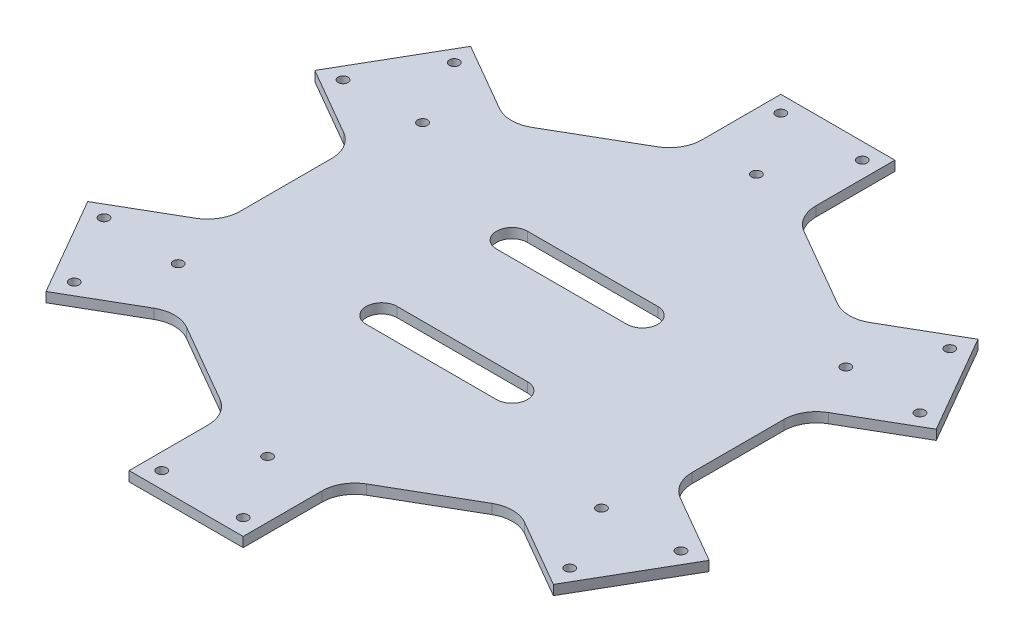
from build123d import *

# Parameters (mm, degrees)
IZIM1_R                     = 1.5
Y_KSEKLIK_EKSTR_ZYON1_DEPTH = 3
KES_EKSTR_ZYON1_DEPTH       = 3


with BuildPart() as part:
    # Çizim1 → Yükseklik-Ekstrüzyon1 (new body)
    with BuildSketch(Plane(origin=(0, 0, 0), x_dir=(1, 0, 0), z_dir=(0, 1, 0))):
        with BuildLine():
            Line((-17.5, 100), (17.5, 100))
            Line((17.5, 100), (17.5, 75.773502692))
            ThreePointArc((17.5, 75.773502692), (18.839745962, 70.773502692), (22.5, 67.113248654))
            Line((22.5, 67.113248654), (46.871778265, 53.042195912))
            ThreePointArc((46.871778265, 53.042195912), (51.871778265, 51.70244995), (56.871778265, 53.042195912))
            Line((56.871778265, 53.042195912), (77.852540378, 65.155444566))
            Line((77.852540378, 65.155444566), (95.352540378, 34.844555434))
            Line((95.352540378, 34.844555434), (74.371778265, 22.73130678))
            ThreePointArc((74.371778265, 22.73130678), (70.711524227, 19.071052742), (69.371778265, 14.071052742))
            Line((69.371778265, 14.071052742), (69.371778265, -14.071052742))
            ThreePointArc((69.371778265, -14.071052742), (70.711524227, -19.071052742), (74.371778265, -22.73130678))
            Line((74.371778265, -22.73130678), (95.352540378, -34.844555434))
            Line((95.352540378, -34.844555434), (77.852540378, -65.155444566))
            Line((77.852540378, -65.155444566), (56.871778265, -53.042195912))
            ThreePointArc((56.871778265, -53.042195912), (51.871778265, -51.70244995), (46.871778265, -53.042195912))
            Line((46.871778265, -53.042195912), (22.5, -67.113248654))
            ThreePointArc((22.5, -67.113248654), (18.839745962, -70.773502692), (17.5, -75.773502692))
            Line((17.5, -75.773502692), (17.5, -100))
            Line((17.5, -100), (-17.5, -100))
            Line((-17.5, -100), (-17.5, -75.773502692))
            ThreePointArc((-17.5, -75.773502692), (-18.839745962, -70.773502692), (-22.5, -67.113248654))
            Line((-22.5, -67.113248654), (-46.871778265, -53.042195912))
            ThreePointArc((-46.871778265, -53.042195912), (-51.871778265, -51.70244995), (-56.871778265, -53.042195912))
            Line((-56.871778265, -53.042195912), (-77.852540378, -65.155444566))
            Line((-77.852540378, -65.155444566), (-95.352540378, -34.844555434))
            Line((-95.352540378, -34.844555434), (-74.371778265, -22.73130678))
            ThreePointArc((-74.371778265, -22.73130678), (-70.711524227, -19.071052742), (-69.371778265, -14.071052742))
            Line((-69.371778265, -14.071052742), (-69.371778265, 14.071052742))
            ThreePointArc((-69.371778265, 14.071052742), (-70.711524227, 19.071052742), (-74.371778265, 22.73130678))
            Line((-74.371778265, 22.73130678), (-95.352540378, 34.844555434))
            Line((-95.352540378, 34.844555434), (-77.852540378, 65.155444566))
            Line((-77.852540378, 65.155444566), (-56.871778265, 53.042195912))
            ThreePointArc((-56.871778265, 53.042195912), (-51.871778265, 51.70244995), (-46.871778265, 53.042195912))
            Line((-46.871778265, 53.042195912), (-22.5, 67.113248654))
            ThreePointArc((-22.5, 67.113248654), (-18.839745962, 70.773502692), (-17.5, 75.773502692))
            Line((-17.5, 75.773502692), (-17.5, 100))
        make_face()
        with Locations(Location((-12.5, 95, 0), (0, 0, 270))):
            Circle(IZIM1_R, mode=Mode.SUBTRACT)
        with Locations(Location((12.5, 95, 0), (0, 0, 270))):
            Circle(IZIM1_R, mode=Mode.SUBTRACT)
        with Locations(Location((0, 75, 0), (0, 0, 270))):
            Circle(IZIM1_R, mode=Mode.SUBTRACT)
        with Locations(Location((64.951905284, 37.5, 0), (0, 0, 270))):
            Circle(IZIM1_R, mode=Mode.SUBTRACT)
        with Locations(Location((88.52241336, 36.674682453, 0), (0, 0, 270))):
            Circle(IZIM1_R, mode=Mode.SUBTRACT)
        with Locations(Location((76.02241336, 58.325317547, 0), (0, 0, 270))):
            Circle(IZIM1_R, mode=Mode.SUBTRACT)
        with Locations(Location((64.951905284, -37.5, 0), (0, 0, 270))):
            Circle(IZIM1_R, mode=Mode.SUBTRACT)
        with Locations(Location((76.02241336, -58.325317547, 0), (0, 0, 270))):
            Circle(IZIM1_R, mode=Mode.SUBTRACT)
        with Locations(Location((88.52241336, -36.674682453, 0), (0, 0, 270))):
            Circle(IZIM1_R, mode=Mode.SUBTRACT)
        with Locations(Location((0, -75, 0), (0, 0, 270))):
            Circle(IZIM1_R, mode=Mode.SUBTRACT)
        with Locations(Location((-12.5, -95, 0), (0, 0, 270))):
            Circle(IZIM1_R, mode=Mode.SUBTRACT)
        with Locations(Location((12.5, -95, 0), (0, 0, 270))):
            Circle(IZIM1_R, mode=Mode.SUBTRACT)
        with Locations(Location((-64.951905284, -37.5, 0), (0, 0, 270))):
            Circle(IZIM1_R, mode=Mode.SUBTRACT)
        with Locations(Location((-88.52241336, -36.674682453, 0), (0, 0, 270))):
            Circle(IZIM1_R, mode=Mode.SUBTRACT)
        with Locations(Location((-76.02241336, -58.325317547, 0), (0, 0, 270))):
            Circle(IZIM1_R, mode=Mode.SUBTRACT)
        with Locations(Location((-64.951905284, 37.5, 0), (0, 0, 270))):
            Circle(IZIM1_R, mode=Mode.SUBTRACT)
        with Locations(Location((-76.02241336, 58.325317547, 0), (0, 0, 270))):
            Circle(IZIM1_R, mode=Mode.SUBTRACT)
        with Locations(Location((-88.52241336, 36.674682453, 0), (0, 0, 270))):
            Circle(IZIM1_R, mode=Mode.SUBTRACT)
    extrude(amount=Y_KSEKLIK_EKSTR_ZYON1_DEPTH)

    # Çizim3 → Kes-Ekstrüzyon1 (cut)
    with BuildSketch(Plane(origin=(0, 3, 0), x_dir=(1, 0, 0), z_dir=(0, 1, 0))):
        with BuildLine():
            Line((-20, 24.75), (20, 24.75))
            ThreePointArc((20, 24.75), (24.75, 20), (20, 15.25))
            Line((20, 15.25), (-20, 15.25))
            ThreePointArc((-20, 15.25), (-24.75, 20), (-20, 24.75))
        make_face()
        with BuildLine():
            Line((-20, -15.25), (20, -15.25))
            ThreePointArc((20, -15.25), (24.75, -20), (20, -24.75))
            Line((20, -24.75), (-20, -24.75))
            ThreePointArc((-20, -24.75), (-24.75, -20), (-20, -15.25))
        make_face()
    extrude(amount=-KES_EKSTR_ZYON1_DEPTH, mode=Mode.SUBTRACT)


solid = part.part
